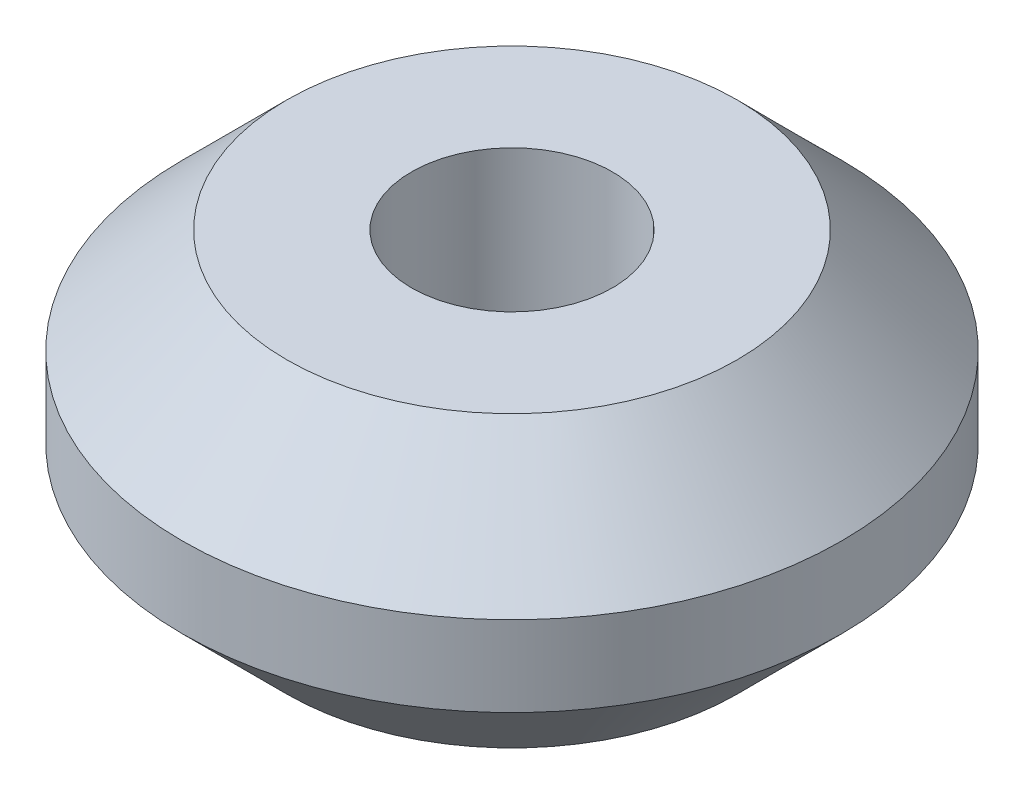
from build123d import *

# Parameters (mm, degrees)
SKETCH1_R           = 20.5
BOSS_EXTRUDE1_DEPTH = 18
CHAMFER1_SIZE       = 6.5
SKETCH2_R           = 6.25
CUT_EXTRUDE1_DEPTH  = 35.124771062


with BuildPart() as part:
    # Sketch1 → Boss-Extrude1 (new body)
    with BuildSketch(Plane(origin=(0, 0, 0), x_dir=(1, 0, 0), z_dir=(0, 1, 0))):
        with Locations(Location((0, 0, 0), (0, 0, 270))):
            Circle(SKETCH1_R)
    extrude(amount=BOSS_EXTRUDE1_DEPTH)

    # Chamfer1
    chamfer1_edges = [part.edges().sort_by_distance(p)[0] for p in [
        (0, 0, -20.5),
        (0, 18, -20.5),
    ]]
    chamfer(chamfer1_edges, length=CHAMFER1_SIZE)

    # Sketch2 → Cut-Extrude1 (cut, through all)
    with BuildSketch(Plane(origin=(0, 18, 0), x_dir=(1, 0, 0), z_dir=(0, 1, 0))):
        with Locations(Location((0, 0, 0), (0, 0, 270))):
            Circle(SKETCH2_R)
    extrude(amount=-CUT_EXTRUDE1_DEPTH, mode=Mode.SUBTRACT)


solid = part.part
